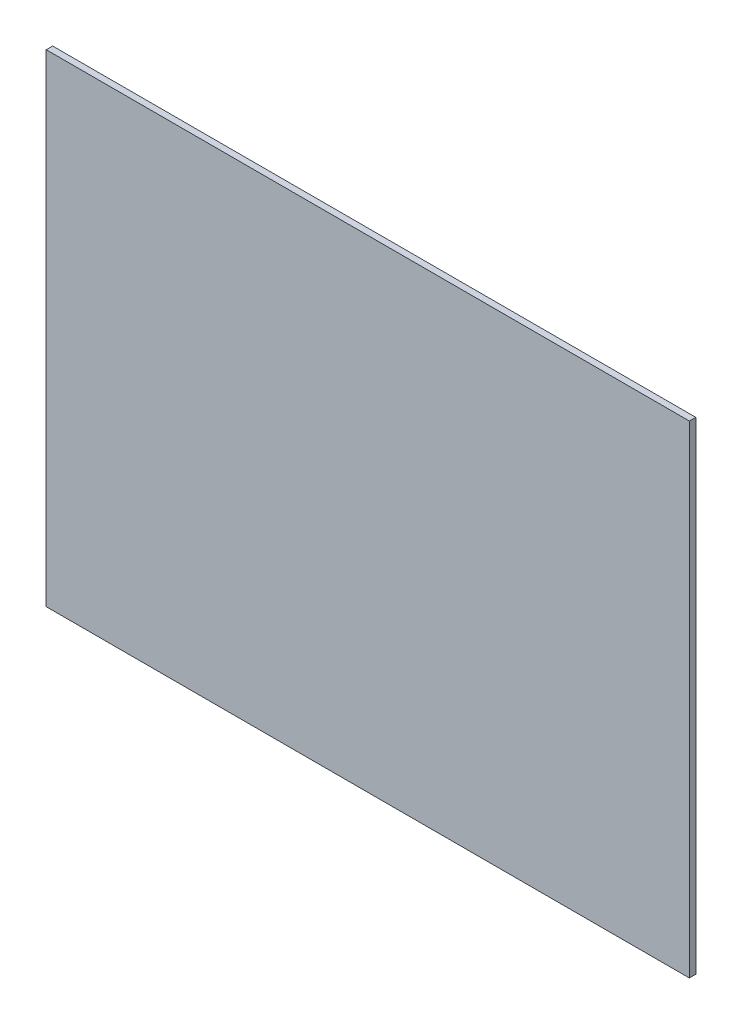
from build123d import *

# Parameters (mm, degrees)
SKETCH1_W           = 200
SKETCH1_H           = 150
BOSS_EXTRUDE1_DEPTH = 2


with BuildPart() as part:
    # Sketch1 → Boss-Extrude1 (new body)
    with BuildSketch(Plane.XY):
        with Locations((100, 75)):
            Rectangle(SKETCH1_W, SKETCH1_H)
    extrude(amount=BOSS_EXTRUDE1_DEPTH)


solid = part.part
